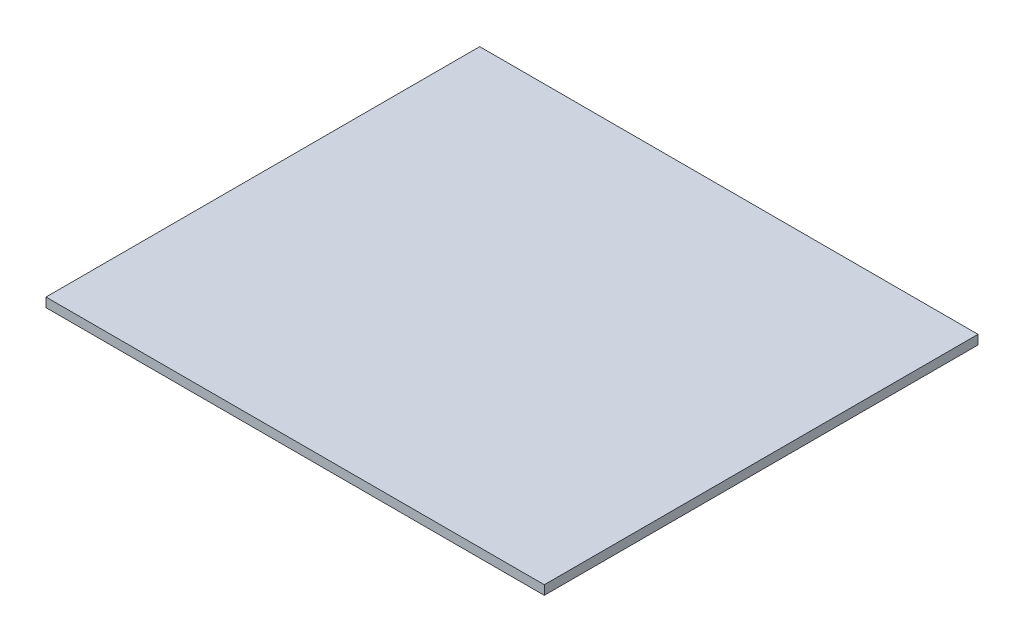
from build123d import *

# Parameters (mm, degrees)
SKIZZE1_W                       = 270
SKIZZE1_H                       = 235
AUFSATZ_LINEAR_AUSTRAGEN1_DEPTH = 5


with BuildPart() as part:
    # Skizze1 → Aufsatz-Linear austragen1 (new body)
    with BuildSketch(Plane(origin=(0, 0, 0), x_dir=(1, 0, 0), z_dir=(0, 1, 0))):
        Rectangle(SKIZZE1_W, SKIZZE1_H)
    extrude(amount=AUFSATZ_LINEAR_AUSTRAGEN1_DEPTH)


solid = part.part
